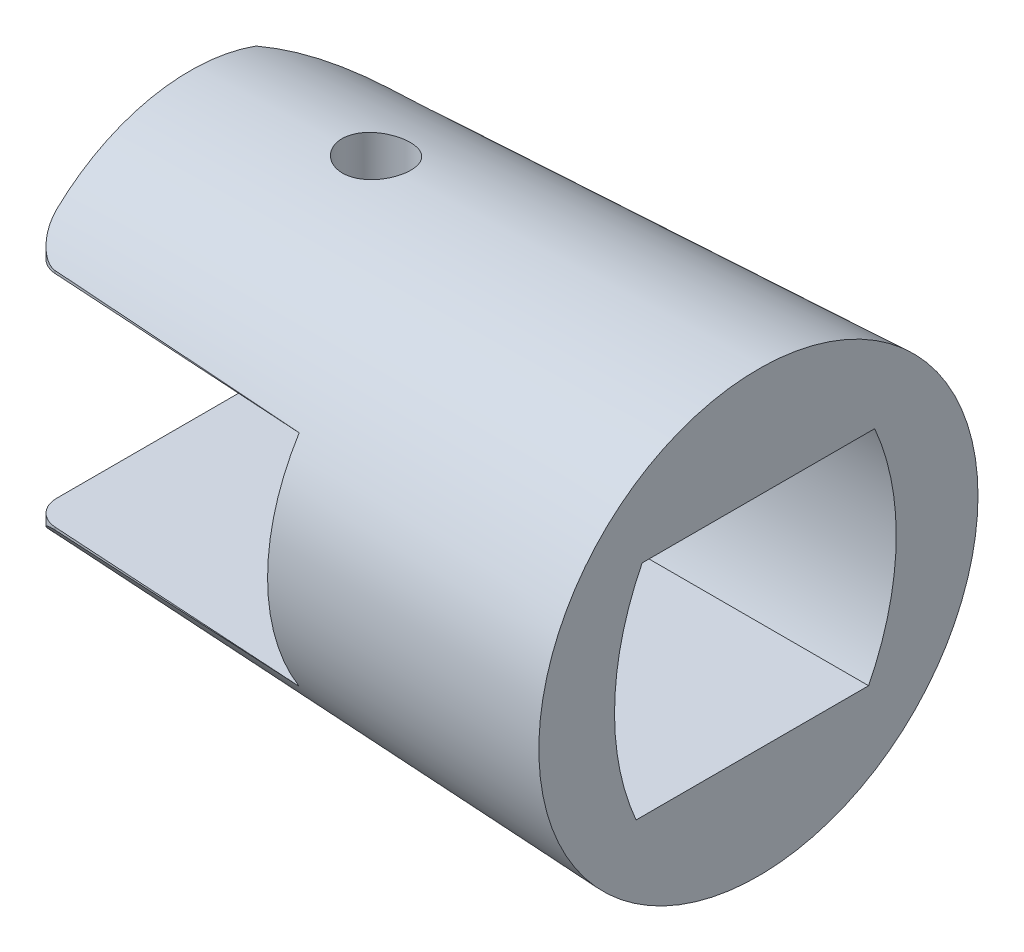
from build123d import *

# Parameters (mm, degrees)
SKETCH2_R               = 7.5
SKETCH1_R               = 8.5
CUT_EXTRUDE1_DEPTH      = 10
CUT_EXTRUDE1_DEPTH_BACK = 10
SKETCH4_W               = 13.984772719
SKETCH4_H               = 8.5
CUT_EXTRUDE2_DEPTH      = 10
CUT_EXTRUDE2_DEPTH_BACK = 10
CUT_EXTRUDE3_DEPTH      = 10
CUT_EXTRUDE3_DEPTH_BACK = 10
SKETCH6_R               = 1.25
CUT_EXTRUDE4_DEPTH      = 12
FILLET1_R               = 1


with BuildPart() as part:
    # Sketch2 → Loft1 section 0
    with BuildSketch(Plane(origin=(-22, 0, 0), x_dir=(0, 0, -1), z_dir=(1, 0, 0))):
        Circle(SKETCH2_R)
    # Sketch1 → Loft1 section 1
    with BuildSketch(Plane(origin=(0, 0, 0), x_dir=(0, 0, -1), z_dir=(1, 0, 0))):
        Circle(SKETCH1_R)
    loft()

    # Sketch4 → Cut-Extrude1 (cut, two sides: drawn at the far end of the back side and taken through both)
    with BuildSketch(Plane.XY.offset(-CUT_EXTRUDE1_DEPTH_BACK)):
        with Locations((-17.99238636, 0)):
            Rectangle(SKETCH4_W, SKETCH4_H)
    extrude(amount=CUT_EXTRUDE1_DEPTH + CUT_EXTRUDE1_DEPTH_BACK, mode=Mode.SUBTRACT)

    # Sketch5 → Cut-Extrude2 (cut, two sides: drawn at the far end of the back side and taken through both)
    with BuildSketch(Plane(origin=(0, 0, 0), x_dir=(1, 0, 0), z_dir=(0, 1, 0)).offset(-CUT_EXTRUDE2_DEPTH_BACK)):
        with BuildLine():
            ThreePointArc((-16.527422763, 6.684642149), (-21.211826581, 3.739953342), (-23.023054805, -1.488266586))
            Line((-23.023054805, -1.488266586), (-23.002284576, -6.042868806))
            Line((-23.002284576, -6.042868806), (-11, -6.777720856))
            Line((-11, -6.777720856), (-11, -8.501479668))
            Line((-11, -8.501479668), (-27.91814199, -8.501479668))
            Line((-27.91814199, -8.501479668), (-27.91814199, 10.370496294))
            Line((-27.91814199, 10.370496294), (-11, 10.370496294))
            Line((-11, 10.370496294), (-11, 6.777720856))
            Line((-11, 6.777720856), (-16.527422763, 6.684642149))
        make_face()
    extrude(amount=CUT_EXTRUDE2_DEPTH + CUT_EXTRUDE2_DEPTH_BACK, mode=Mode.SUBTRACT)

    # Sketch6 → Cut-Extrude3 (cut, two sides: drawn at the far end of the back side and taken through both)
    with BuildSketch(Plane(origin=(0, 0, 0), x_dir=(1, 0, 0), z_dir=(0, 1, 0)).offset(-CUT_EXTRUDE3_DEPTH_BACK)):
        with Locations(Location((-15.3, 0.5, 0), (0, 0, 135.995761061))):
            Circle(SKETCH6_R)
    extrude(amount=CUT_EXTRUDE3_DEPTH + CUT_EXTRUDE3_DEPTH_BACK, mode=Mode.SUBTRACT)

    # Sketch8 → Cut-Extrude4 (cut)
    with BuildSketch(Plane(origin=(0, 0, 0), x_dir=(0, 0, -1), z_dir=(1, 0, 0))):
        with BuildLine():
            Line((-4.5, 4.25), (4.5, 4.25))
            ThreePointArc((4.5, 4.25), (5.331033358, -0.026207333), (4.26513416, -4.25))
            Line((4.26513416, -4.25), (-4.73486584, -4.25))
            ThreePointArc((-4.73486584, -4.25), (-5.565899198, 0.026207333), (-4.5, 4.25))
        make_face()
    extrude(amount=-CUT_EXTRUDE4_DEPTH, mode=Mode.SUBTRACT)

    # Fillet1
    fillet1_edges = [part.edges().sort_by_distance(p)[0] for p in [
        (-22, -4.303779405, 6.104234696),
        (-22, 4.303779405, 6.104234696),
    ]]
    fillet(fillet1_edges, radius=FILLET1_R)


solid = part.part
